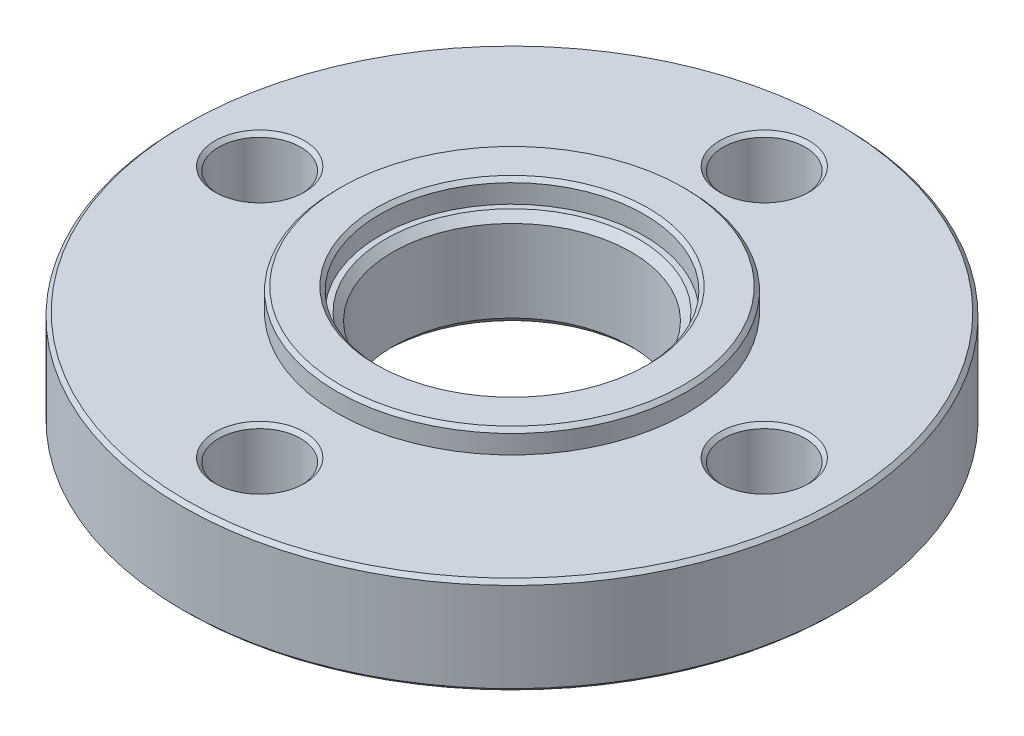
from build123d import *

# Parameters (mm, degrees)
CORTAR_EXTRUIR1_DEPTH      = 64.295931939
CORTAR_EXTRUIR1_DEPTH_BACK = 64.295931939
CROQUIS2_R                 = 5.5
CHAFL_N1_SIZE              = 1
CHAFL_N2_SIZE              = 0.5


with BuildPart() as part:
    # Croquis1 → Revolución1 (revolve)
    with BuildSketch(Plane(origin=(0, 0, 0), x_dir=(0, 0, -1), z_dir=(1, 0, 0))):
        Polygon((-16, -6.5), (-16, 6.5), (-17.75, 6.5), (-17.75, 9.5), (-23.5, 9.5), (-23.5, 6.5), (-44.25, 6.5), (-44.25, -6.5), align=None)
    revolve(axis=Axis((0, 0, 0), (0, -1, 0)))

    # Croquis2 → Cortar-Extruir1 (cut, two sides: drawn at the far end of the back side and taken through both)
    with BuildSketch(Plane(origin=(0, 0, 0), x_dir=(1, 0, 0), z_dir=(0, 1, 0)).offset(-CORTAR_EXTRUIR1_DEPTH_BACK)):
        with Locations(Location((0, 33.875, 0), (0, 0, 270))):
            Circle(CROQUIS2_R)
        with Locations(Location((33.875, 0, 0), (0, 0, 270))):
            Circle(CROQUIS2_R)
        with Locations(Location((0, -33.875, 0), (0, 0, 270))):
            Circle(CROQUIS2_R)
        with Locations(Location((-33.875, 0, 0), (0, 0, 270))):
            Circle(CROQUIS2_R)
    extrude(amount=CORTAR_EXTRUIR1_DEPTH + CORTAR_EXTRUIR1_DEPTH_BACK, mode=Mode.SUBTRACT)

    # Chaflán1
    chafl_n1_edges = [part.edges().sort_by_distance(p)[0] for p in [
        (0, 6.5, -16),
        (0, -6.5, -16),
    ]]
    chamfer(chafl_n1_edges, length=CHAFL_N1_SIZE)

    # Chaflán2
    chafl_n2_edges = [part.edges().sort_by_distance(p)[0] for p in [
        (0, 6.5, -39.375),
        (0, -6.5, -39.375),
        (33.875, 6.5, -5.5),
        (33.875, -6.5, -5.5),
        (0, 6.5, 28.375),
        (0, -6.5, 28.375),
        (-33.875, 6.5, -5.5),
        (-33.875, -6.5, -5.5),
        (0, -6.5, -44.25),
        (0, 6.5, -44.25),
        (0, 9.5, -23.5),
        (0, 9.5, -17.75),
    ]]
    chamfer(chafl_n2_edges, length=CHAFL_N2_SIZE)


solid = part.part
